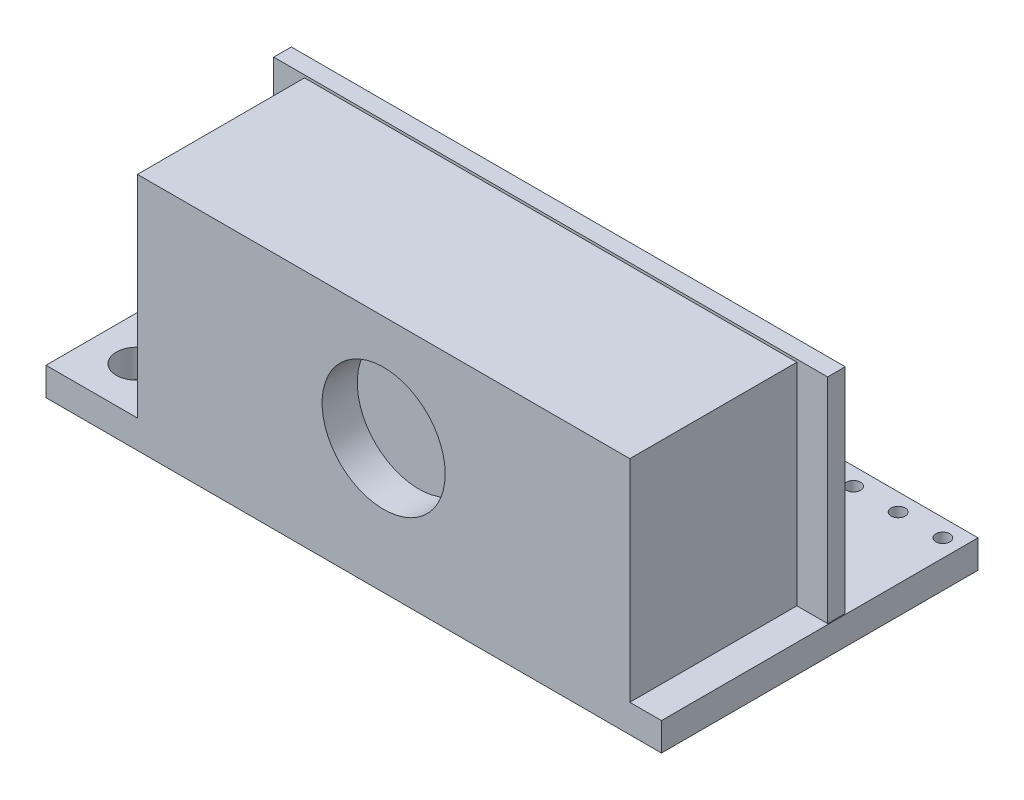
from build123d import *

# Parameters (mm, degrees)
SKETCH_2_W          = 28
SKETCH_2_H          = 12
EXTRUDE_1_DEPTH     = 9.5
SKETCH_3_W          = 31.5
SKETCH_3_H          = 12.3
EXTRUDE_2_DEPTH     = 1
SKETCH_4_W          = 35
SKETCH_4_H          = 18
SKETCH_4_R          = 1.15
SKETCH_4_R_2        = 0.4
EXTRUDE_3_DEPTH     = 1.6
SKETCH_6_R          = 3.5
CUT_EXTRUDE_1_DEPTH = 2


with BuildPart() as part:
    # 草图2 → 凸台-拉伸1 (new body)
    with BuildSketch(Plane.XY):
        Rectangle(SKETCH_2_W, SKETCH_2_H)
    extrude(amount=EXTRUDE_1_DEPTH)

    # 草图3 → 凸台-拉伸2 (add)
    with BuildSketch(Plane(origin=(0, 0, 0), x_dir=(-1, 0, 0), z_dir=(0, 0, -1))):
        Rectangle(SKETCH_3_W, SKETCH_3_H)
    extrude(amount=EXTRUDE_2_DEPTH)

    # 草图4 → 凸台-拉伸3 (add)
    with BuildSketch(Plane.XZ.offset(6)):
        with Locations((-1.7, 0.5)):
            Rectangle(SKETCH_4_W, SKETCH_4_H)
        with Locations(Location((-16.7, 6.85, 0), (0, 0, 270))):
            Circle(SKETCH_4_R, mode=Mode.SUBTRACT)
        with Locations(Location((14.8, -7.5, 0), (0, 0, 270))):
            Circle(SKETCH_4_R_2, mode=Mode.SUBTRACT)
        with Locations(Location((12.26, -7.5, 0), (0, 0, 270))):
            Circle(SKETCH_4_R_2, mode=Mode.SUBTRACT)
        with Locations(Location((9.72, -7.5, 0), (0, 0, 270))):
            Circle(SKETCH_4_R_2, mode=Mode.SUBTRACT)
        with Locations(Location((7.18, -7.5, 0), (0, 0, 270))):
            Circle(SKETCH_4_R_2, mode=Mode.SUBTRACT)
        with Locations(Location((4.64, -7.5, 0), (0, 0, 270))):
            Circle(SKETCH_4_R_2, mode=Mode.SUBTRACT)
    extrude(amount=EXTRUDE_3_DEPTH)

    # 草图6 → 切除-拉伸1 (cut)
    with BuildSketch(Plane.XY.offset(9.5)):
        Circle(SKETCH_6_R)
    extrude(amount=-CUT_EXTRUDE_1_DEPTH, mode=Mode.SUBTRACT)


solid = part.part
